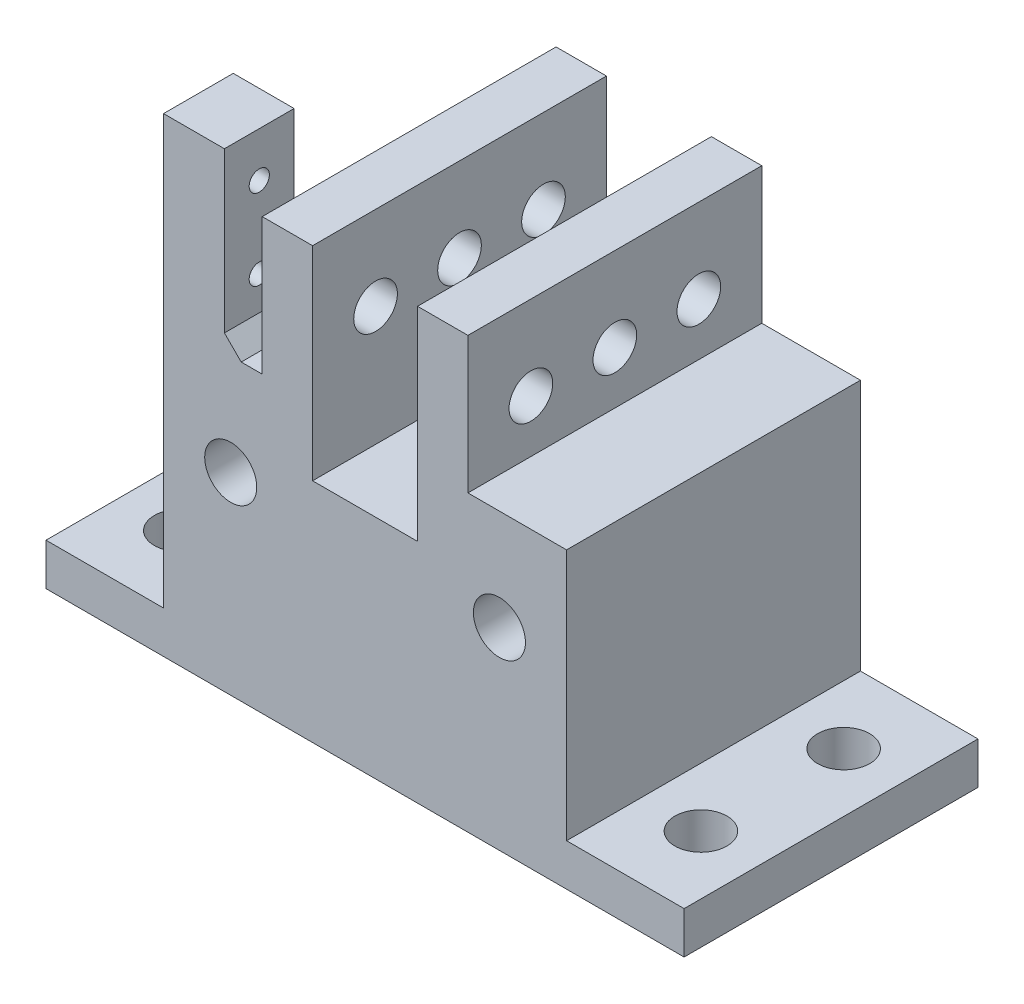
from build123d import *

# Parameters (mm, degrees)
SKETCH1_R                = 3.1
BOSS_EXTRUDE1_DEPTH      = 35
SKETCH2_R                = 3.1
BOSS_EXTRUDE2_DEPTH      = 20
BOSS_EXTRUDE3_DEPTH      = 35
SKETCH4_R                = 2.6
CUT_EXTRUDE1_DEPTH       = 59.014006929
SKETCH6_W                = 12.5
SKETCH6_H                = 8
CUT_EXTRUDE2_DEPTH       = 58.241265709
SKETCH7_W                = 48
SKETCH7_H                = 35
BOSS_EXTRUDE4_DEPTH      = 10
SKETCH8_W                = 14
SKETCH8_H                = 35
SKETCH8_R                = 3.1
BOSS_EXTRUDE5_DEPTH      = 5
BOSS_EXTRUDE6_DEPTH      = 2.4
BOSS_EXTRUDE6_DEPTH_BACK = 4.85
SKETCH9_R                = 1.2
CHAMFER1_SIZE            = 2


with BuildPart() as part:
    # Sketch1 → Boss-Extrude1 (new body)
    with BuildSketch(Plane.XY):
        Polygon((-5, -3.75), (-35, -3.75), (-35, -28.75), (13, -28.75), (13, -3.75), align=None)
        with Locations((5, -15.75)):
            Circle(SKETCH1_R, mode=Mode.SUBTRACT)
        with Locations((-27, -15.75)):
            Circle(SKETCH1_R, mode=Mode.SUBTRACT)
    extrude(amount=BOSS_EXTRUDE1_DEPTH)

    # Sketch2 → Boss-Extrude2 (add)
    with BuildSketch(Plane(origin=(0, 0, 0), x_dir=(-1, 0, 0), z_dir=(0, 0, -1))):
        with Locations((27, -15.75)):
            Circle(SKETCH2_R)
        with Locations((-5, -15.75)):
            Circle(SKETCH2_R)
    extrude(amount=-BOSS_EXTRUDE2_DEPTH)

    # Sketch3 → Boss-Extrude3 (add)
    with BuildSketch(Plane.XY.offset(35)):
        Polygon((-17.25, 2.5), (-17.25, -7.5), (-23.25, -7.5), (-23.25, 12.5), (-17.25, 12.5), align=None)
        Polygon((-4.75, 2.5), (-4.75, -7.5), (1.25, -7.5), (1.25, 12.5), (-4.75, 12.5), align=None)
    extrude(amount=-BOSS_EXTRUDE3_DEPTH)

    # Sketch4 → Cut-Extrude1 (cut, through all)
    with BuildSketch(Plane.ZY.offset(23.25)):
        with Locations((17.5, 2.5)):
            Circle(SKETCH4_R)
        with Locations((27.5, 2.5)):
            Circle(SKETCH4_R)
        with Locations((7.5, 2.5)):
            Circle(SKETCH4_R)
    extrude(amount=-CUT_EXTRUDE1_DEPTH, mode=Mode.SUBTRACT)

    # Sketch6 → Cut-Extrude2 (cut, through all)
    with BuildSketch(Plane.XY.offset(35)):
        with Locations((-11, -7.75)):
            Rectangle(SKETCH6_W, SKETCH6_H)
    extrude(amount=-CUT_EXTRUDE2_DEPTH, mode=Mode.SUBTRACT)

    # Sketch7 → Boss-Extrude4 (add)
    with BuildSketch(Plane.XZ.offset(28.75)):
        with Locations((-11, 17.5)):
            Rectangle(SKETCH7_W, SKETCH7_H)
    extrude(amount=BOSS_EXTRUDE4_DEPTH)

    # Sketch8 → Boss-Extrude5 (add)
    # profile 1 of 2: a face of its own
    with BuildSketch(Plane.XZ.offset(38.75)):
        with Locations((-42, 17.5)):
            Rectangle(SKETCH8_W, SKETCH8_H)
        with Locations(Location((-42, 9, 0), (0, 0, 270))):
            Circle(SKETCH8_R, mode=Mode.SUBTRACT)
        with Locations(Location((-42, 26, 0), (0, 0, 270))):
            Circle(SKETCH8_R, mode=Mode.SUBTRACT)
    # profile 2 of 2: a face of its own
    with BuildSketch(Plane.XZ.offset(38.75)):
        with Locations((20, 17.5)):
            Rectangle(SKETCH8_W, SKETCH8_H)
        with Locations(Location((20, 9, 0), (0, 0, 90))):
            Circle(SKETCH8_R, mode=Mode.SUBTRACT)
        with Locations(Location((20, 26, 0), (0, 0, 270))):
            Circle(SKETCH8_R, mode=Mode.SUBTRACT)
    extrude(amount=-BOSS_EXTRUDE5_DEPTH)

    # Sketch9 → Boss-Extrude6 (add, two sides: drawn at the far end of the back side and taken through both)
    with BuildSketch(Plane(origin=(-30.15, 41.369079409, 256.718616892), x_dir=(0, 0, -1), z_dir=(1, 0, 0)).offset(-BOSS_EXTRUDE6_DEPTH_BACK)):
        Polygon((230.018616892, -24.119079409), (230.018616892, -45.119079409), (230.018616892, -49.119079409), (221.718616892, -49.119079409), (221.718616892, -24.119079409), align=None)
        with Locations(Location((225.868616892, -29.469079409, 0), (0, 0, 90))):
            Circle(SKETCH9_R, mode=Mode.SUBTRACT)
        with Locations(Location((225.868616892, -39.069079409, 0), (0, 0, 90))):
            Circle(SKETCH9_R, mode=Mode.SUBTRACT)
    extrude(amount=BOSS_EXTRUDE6_DEPTH + BOSS_EXTRUDE6_DEPTH_BACK)

    # Chamfer1
    chamfer1_edges = [part.edges().sort_by_distance(p)[0] for p in [
        (-27.75, -3.75, 30.85),
        (-31.375, -3.75, 26.7),
    ]]
    chamfer(chamfer1_edges, length=CHAMFER1_SIZE)


solid = part.part
